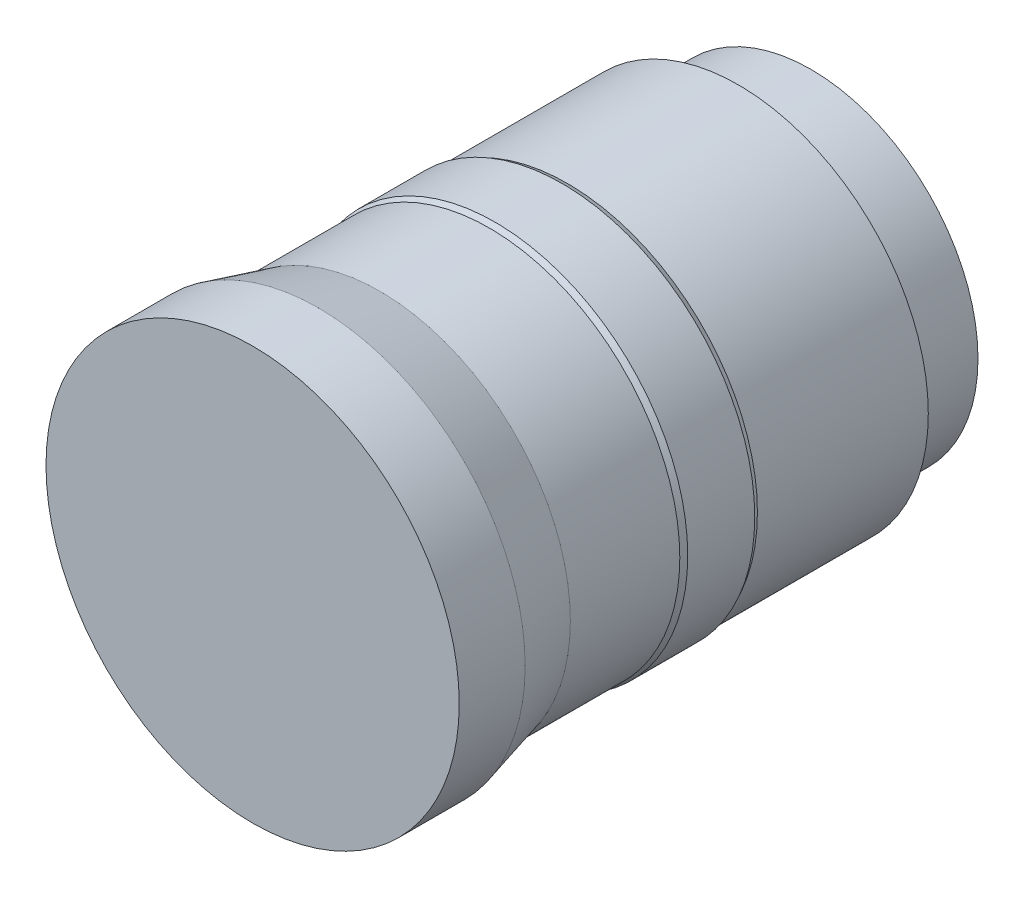
from build123d import *


with BuildPart() as part:
    # 草图1 → 旋转1 (revolve)
    with BuildSketch(Plane(origin=(0, 0, 0), x_dir=(0, 0, -1), z_dir=(1, 0, 0)), mode=Mode.PRIVATE) as revolve_1_sk:
        Polygon((0, 0), (0, 14.95), (-6.5, 14.95), (-6.5, 17), (-21.8, 17), (-22.28875, 17.25), (-28.28875, 17.25), (-28.8, 17.05), (-38.6, 17.05), (-44.1, 18.5), (-50, 18.5), (-50, 0), align=None)
    revolve(revolve_1_sk.sketch.rotate(Axis((0, 0, 50), (0, 0, -1)), 90), axis=Axis((0, 0, 50), (0, 0, -1)))


solid = part.part
